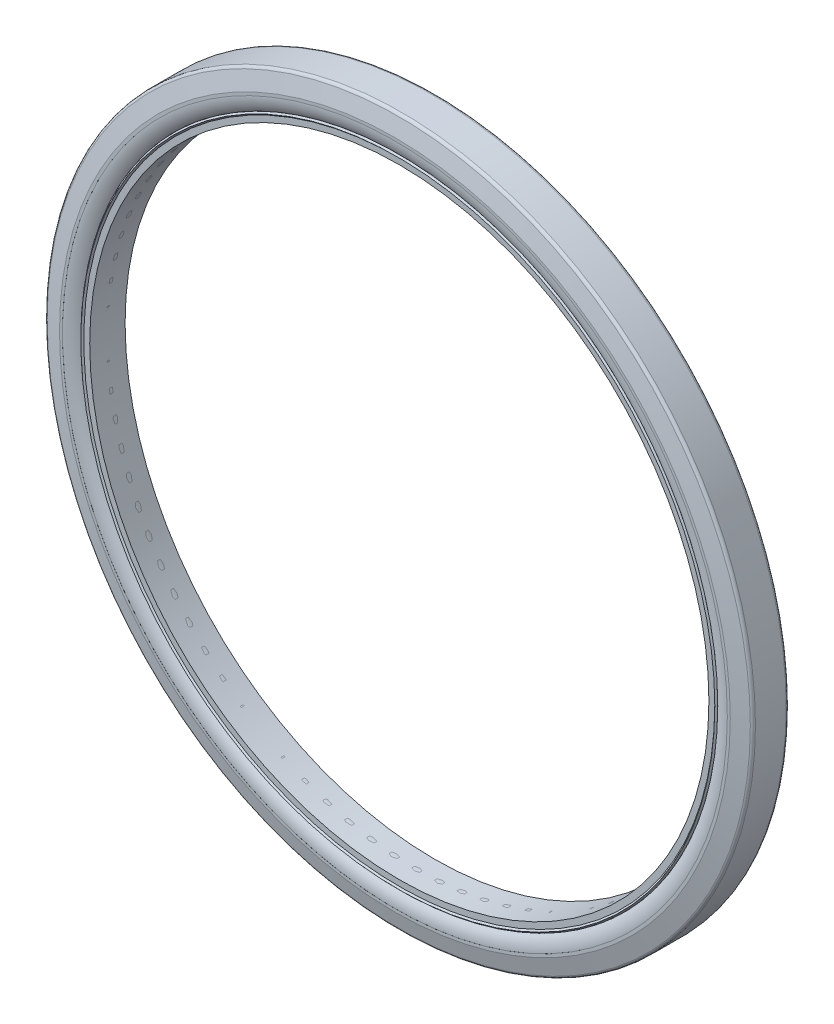
from build123d import *

# Parameters (mm, degrees)
SKETCH1_R = 1.5


with BuildPart() as part:
    # Sketch1 → Revolve1 (revolve)
    with BuildSketch(Plane(origin=(0, 0, 0), x_dir=(0, 0, -1), z_dir=(1, 0, 0)), mode=Mode.PRIVATE) as revolve1_sk:
        with Locations((0, 22.5)):
            Circle(SKETCH1_R)
    revolve(revolve1_sk.sketch.rotate(Axis((0, 0, 0), (0, 0, 1)), 90), axis=Axis((0, 0, 0), (0, 0, 1)))


with BuildPart() as body_2:
    # Sketch2 → SEAL RING Revolve2 (revolve)
    with BuildSketch(Plane(origin=(0, 0, 0), x_dir=(0, 0, -1), z_dir=(1, 0, 0)), mode=Mode.PRIVATE) as seal_ring_revolve2_sk:
        with BuildLine():
            Line((-1.042320638, 24), (1.042320638, 24))
            ThreePointArc((1.042320638, 24), (1.166145276, 23.957058776), (1.236798098, 23.84667459))
            Line((1.236798098, 23.84667459), (1.5, 22.75))
            Line((1.5, 22.75), (1.5, 22.55))
            Line((1.5, 22.55), (1.2, 22.55))
            Line((1.2, 22.55), (1.2, 21.6))
            Line((1.2, 21.6), (1.3, 21.5))
            Line((1.3, 21.5), (1.2, 21.4))
            Line((1.2, 21.4), (1.2, 21))
            Line((1.2, 21), (-1.2, 21))
            Line((-1.2, 21), (-1.2, 21.4))
            Line((-1.2, 21.4), (-1.3, 21.5))
            Line((-1.3, 21.5), (-1.2, 21.6))
            Line((-1.2, 21.6), (-1.2, 22.55))
            Line((-1.2, 22.55), (-1.5, 22.55))
            Line((-1.5, 22.55), (-1.5, 22.75))
            Line((-1.5, 22.75), (-1.236798098, 23.84667459))
            ThreePointArc((-1.236798098, 23.84667459), (-1.166145276, 23.957058776), (-1.042320638, 24))
        make_face()
    revolve(seal_ring_revolve2_sk.sketch.rotate(Axis((0, 0, 0), (0, 0, -1)), 90), axis=Axis((0, 0, 0), (0, 0, -1)))


solid = Compound([part.part, body_2.part])
